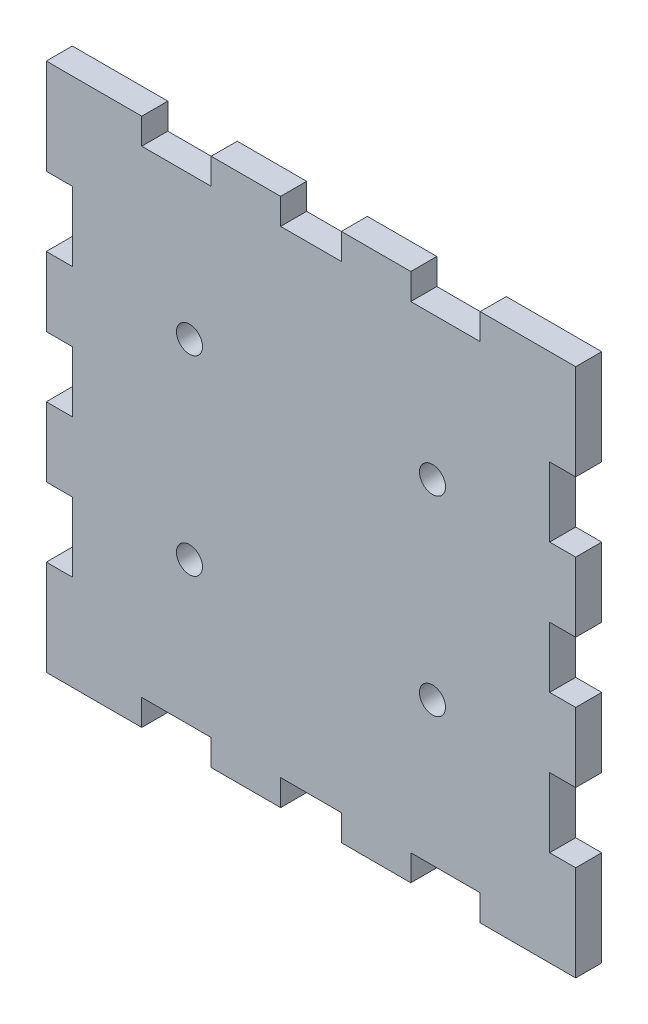
from build123d import *

# Parameters (mm, degrees)
SKETCH1_W           = 61
SKETCH1_H           = 61
BOSS_EXTRUDE1_DEPTH = 3
SKETCH2_W           = 3
SKETCH2_H           = 8
SKETCH2_H_2         = 7
SKETCH2_W_2         = 8
SKETCH2_H_3         = 3
SKETCH2_W_3         = 7
CUT_EXTRUDE1_DEPTH  = 3
CUT_EXTRUDE2_DEPTH  = 3


with BuildPart() as part:
    # Sketch1 → Boss-Extrude1 (new body)
    with BuildSketch(Plane.XY):
        Rectangle(SKETCH1_W, SKETCH1_H)
    extrude(amount=BOSS_EXTRUDE1_DEPTH)

    # Sketch2 → Cut-Extrude1 (cut)
    with BuildSketch(Plane.XY.offset(3)):
        with Locations((-29, 15.5)):
            Rectangle(SKETCH2_W, SKETCH2_H)
        with Locations((-29, 0)):
            Rectangle(SKETCH2_W, SKETCH2_H_2)
        with Locations((-29, -15.5)):
            Rectangle(SKETCH2_W, SKETCH2_H)
        with Locations((-15.5, -29)):
            Rectangle(SKETCH2_W_2, SKETCH2_H_3)
        with Locations((0, -29)):
            Rectangle(SKETCH2_W_3, SKETCH2_H_3)
        with Locations((15.5, -29)):
            Rectangle(SKETCH2_W_2, SKETCH2_H_3)
        with Locations((29, -15.5)):
            Rectangle(SKETCH2_W, SKETCH2_H)
        with Locations((29, 0)):
            Rectangle(SKETCH2_W, SKETCH2_H_2)
        with Locations((29, 15.5)):
            Rectangle(SKETCH2_W, SKETCH2_H)
        with Locations((15.5, 29)):
            Rectangle(SKETCH2_W_2, SKETCH2_H_3)
        with Locations((0, 29)):
            Rectangle(SKETCH2_W_3, SKETCH2_H_3)
        with Locations((-15.5, 29)):
            Rectangle(SKETCH2_W_2, SKETCH2_H_3)
    extrude(amount=-CUT_EXTRUDE1_DEPTH, mode=Mode.SUBTRACT)

    # Sketch3 → Cut-Extrude2 (cut)
    with BuildSketch(Plane.XY.offset(3)):
        with BuildLine():
            ThreePointArc((-12.5, 11), (-15.060660172, 12.060660172), (-14, 9.5))
            Line((-14, 9.5), (-14, 11))
            Line((-14, 11), (-12.5, 11))
        make_face()
        with BuildLine():
            Line((-14, 11), (-14, 9.5))
            ThreePointArc((-14, 9.5), (-12.939339828, 9.939339828), (-12.5, 11))
            Line((-12.5, 11), (-14, 11))
        make_face()
        with BuildLine():
            ThreePointArc((12.5, 11), (12.939339828, 9.939339828), (14, 9.5))
            Line((14, 9.5), (14, 11))
            Line((14, 11), (12.5, 11))
        make_face()
        with BuildLine():
            Line((14, 11), (14, 9.5))
            ThreePointArc((14, 9.5), (15.060660172, 9.939339828), (15.5, 11))
            ThreePointArc((15.5, 11), (14, 12.5), (12.5, 11))
            Line((12.5, 11), (14, 11))
        make_face()
        with BuildLine():
            Line((-14, -9.5), (-14, -11))
            Line((-14, -11), (-12.5, -11))
            ThreePointArc((-12.5, -11), (-12.939339828, -9.939339828), (-14, -9.5))
        make_face()
        with BuildLine():
            Line((-12.5, -11), (-14, -11))
            Line((-14, -11), (-14, -9.5))
            ThreePointArc((-14, -9.5), (-15.060660172, -12.060660172), (-12.5, -11))
        make_face()
        with BuildLine():
            ThreePointArc((14, -9.5), (12.939339828, -9.939339828), (12.5, -11))
            Line((12.5, -11), (14, -11))
            Line((14, -11), (14, -9.5))
        make_face()
        with BuildLine():
            Line((14, -11), (12.5, -11))
            ThreePointArc((12.5, -11), (14, -12.5), (15.5, -11))
            ThreePointArc((15.5, -11), (15.060660172, -9.939339828), (14, -9.5))
            Line((14, -9.5), (14, -11))
        make_face()
    extrude(amount=-CUT_EXTRUDE2_DEPTH, mode=Mode.SUBTRACT)


solid = part.part
